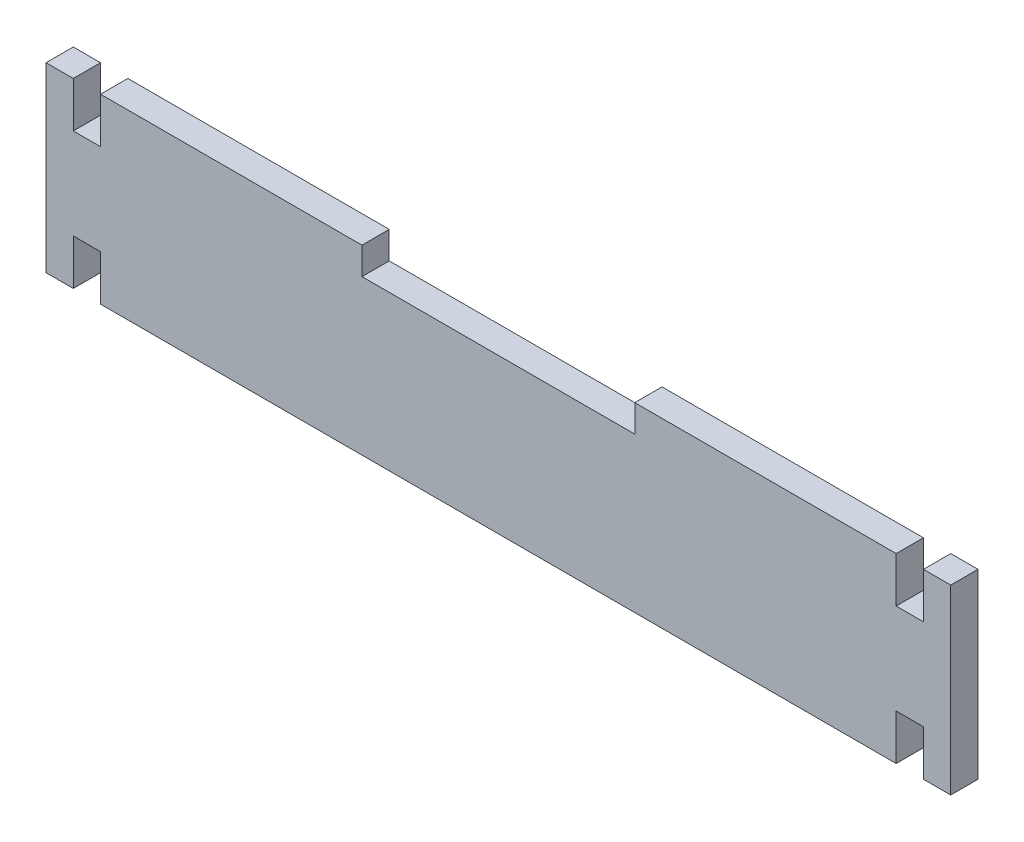
from build123d import *

# Parameters (mm, degrees)
SKETCH1_W            = 199
SKETCH1_H            = 40
BOSS_EXTRUDE1_DEPTH  = 6
SKETCH2_W            = 6
SKETCH2_H            = 10
CUT_EXTRUDE1_DEPTH   = 204.068953806
LPATTERN1_COUNT      = 2
LPATTERN1_PITCH      = 181
LPATTERN1_COUNT_DIR2 = 2
LPATTERN1_PITCH_DIR2 = 30
SKETCH3_W            = 60
SKETCH3_H            = 6
CUT_EXTRUDE2_DEPTH   = 204.068953806


with BuildPart() as part:
    # Sketch1 → Boss-Extrude1 (new body)
    with BuildSketch(Plane.XY):
        with Locations((-99.5, 20)):
            Rectangle(SKETCH1_W, SKETCH1_H)
    extrude(amount=BOSS_EXTRUDE1_DEPTH)

    # Sketch2 → Cut-Extrude1 (cut, through all)
    with BuildSketch(Plane.XY.offset(6)):
        with Locations((-190, 35)):
            Rectangle(SKETCH2_W, SKETCH2_H)
    cut_extrude1 = extrude(amount=-CUT_EXTRUDE1_DEPTH, mode=Mode.SUBTRACT)

    # LPattern1: Cut-Extrude1 2 × 2
    with Locations(*[(i * LPATTERN1_PITCH, -j * LPATTERN1_PITCH_DIR2, 0) for i in range(LPATTERN1_COUNT) for j in range(LPATTERN1_COUNT_DIR2) if (i, j) != (0, 0)]):
        add(cut_extrude1, mode=Mode.SUBTRACT)

    # Sketch3 → Cut-Extrude2 (cut, through all)
    with BuildSketch(Plane.XY.offset(6)):
        with Locations((-99.5, 37)):
            Rectangle(SKETCH3_W, SKETCH3_H)
    extrude(amount=-CUT_EXTRUDE2_DEPTH, mode=Mode.SUBTRACT)


solid = part.part
